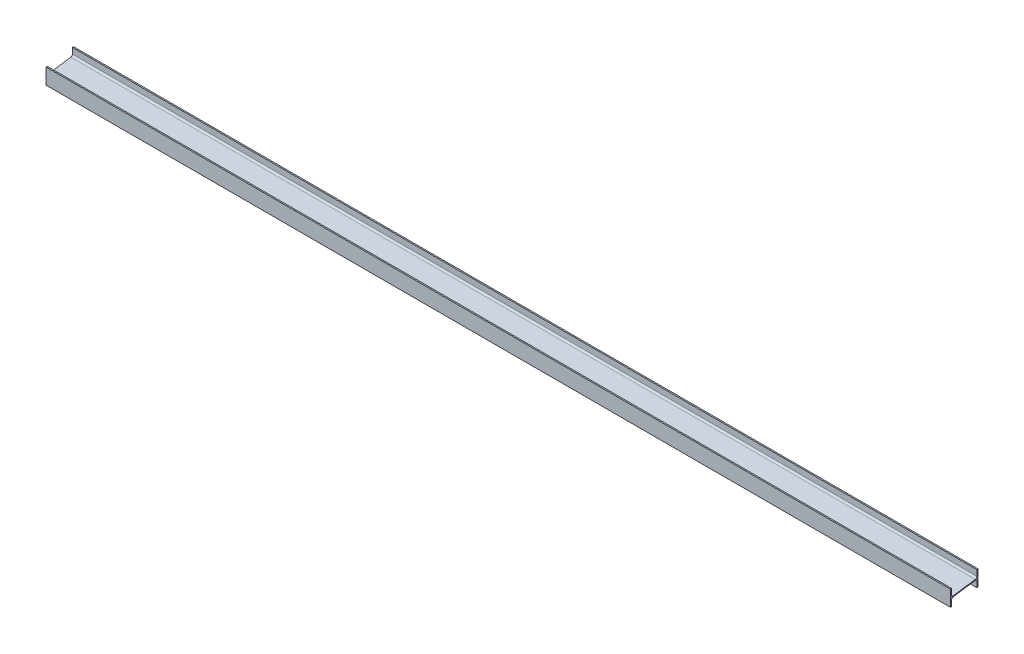
from build123d import *

# Parameters (mm, degrees)
MEMBER_20_1_1_DEPTH      = 5780
CUT_EXTRUDE_1_DEPTH      = 5782.729844951
CUT_EXTRUDE_1_DEPTH_BACK = 5782.729844951


with BuildPart() as part:
    # Sketch11 → Member 20_1_1 (new body)
    with BuildSketch(Plane.YZ):
        with BuildLine():
            Line((-13.75, -92), (-50, -92))
            Line((-50, -92), (-50, -100))
            Line((-50, -100), (50, -100))
            Line((50, -100), (50, -92))
            Line((50, -92), (13.75, -92))
            ThreePointArc((13.75, -92), (5.971825407, -88.778174593), (2.75, -81))
            Line((2.75, -81), (2.75, 81))
            ThreePointArc((2.75, 81), (5.971825407, 88.778174593), (13.75, 92))
            Line((13.75, 92), (50, 92))
            Line((50, 92), (50, 100))
            Line((50, 100), (-50, 100))
            Line((-50, 100), (-50, 92))
            Line((-50, 92), (-13.75, 92))
            ThreePointArc((-13.75, 92), (-5.971825407, 88.778174593), (-2.75, 81))
            Line((-2.75, 81), (-2.75, -81))
            ThreePointArc((-2.75, -81), (-5.971825407, -88.778174593), (-13.75, -92))
        make_face()
    extrude(amount=MEMBER_20_1_1_DEPTH)

    # Эскиз2 → Вырез-Вытянуть1 (cut, two sides: drawn at the far end of the back side and taken through both)
    with BuildSketch(Plane(origin=(0, -50, 0), x_dir=(1, 0, 0), z_dir=(0, 1, 0)).offset(-CUT_EXTRUDE_1_DEPTH_BACK)):
        Polygon((0, 100), (25, -100), (0, -100), align=None)
        Polygon((5780, 100), (5755, 100), (5780, -100), align=None)
    extrude(amount=CUT_EXTRUDE_1_DEPTH + CUT_EXTRUDE_1_DEPTH_BACK, mode=Mode.SUBTRACT)


solid = part.part
